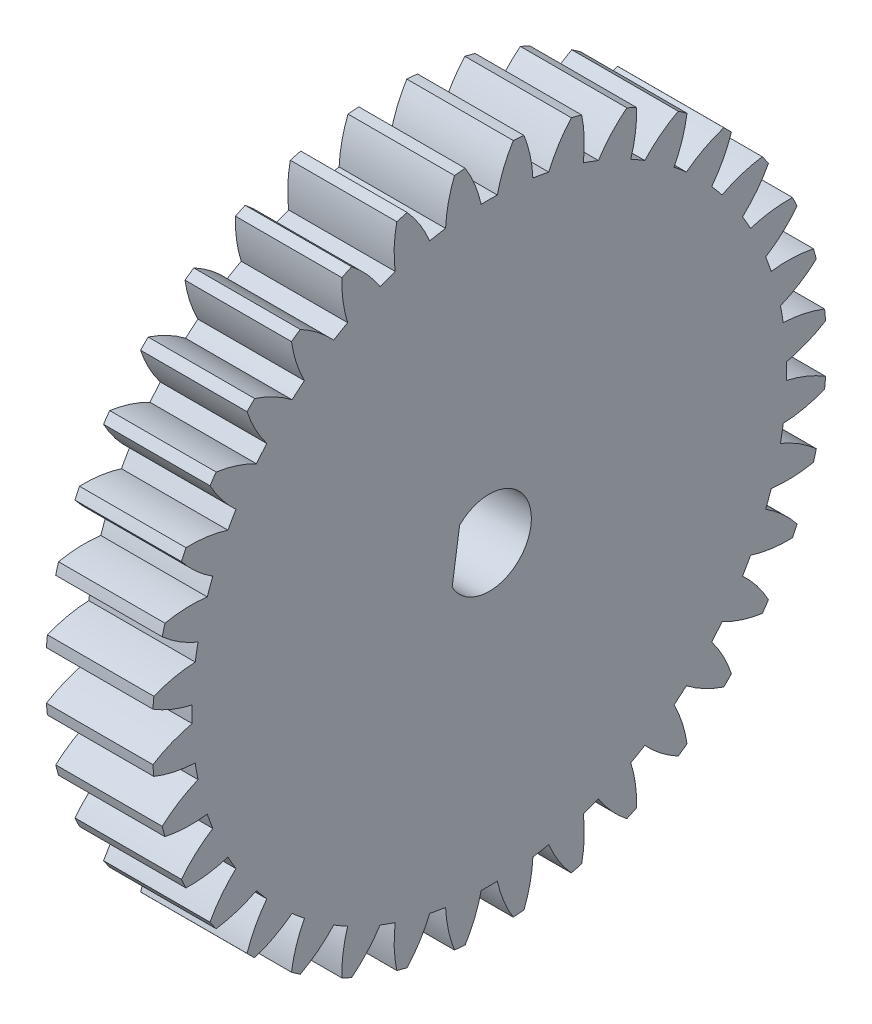
from build123d import *

# Parameters (mm, degrees)
BASPROSKE_W         = 6
BASPROSKE_H         = 19
TOOTHCUT_DEPTH      = 28.531799796
TEETHCUTS_COUNT     = 36
BORE_DEPTH          = 50.0000508
SKETCH4_R           = 6.369355929
BOSS_EXTRUDE1_DEPTH = 6
CUT_EXTRUDE1_DEPTH  = 6


with BuildPart() as part:
    # BasProSke → Base-Revolve (revolve)
    with BuildSketch(Plane(origin=(0, 0, 0), x_dir=(1, 0, 0), z_dir=(0, 1, 0)), mode=Mode.PRIVATE) as base_revolve_sk:
        with Locations((3, 9.5)):
            Rectangle(BASPROSKE_W, BASPROSKE_H)
    revolve(base_revolve_sk.sketch.rotate(Axis((-10, 0, 0), (1, 0, 0)), 180), axis=Axis((-10, 0, 0), (1, 0, 0)))

    # TooCutSke → ToothCut (cut, through all)
    with BuildSketch(Plane(origin=(0, 0, 0), x_dir=(0, 0, -1), z_dir=(1, 0, 0))):
        with BuildLine():
            ThreePointArc((0.454664826, 16.742827745), (0, 16.749), (-0.454664826, 16.742827745))
            ThreePointArc((-0.454664826, 16.742827745), (-0.817558311, 17.898033097), (-1.368909141, 18.976088452))
            ThreePointArc((-1.368909141, 18.976088452), (0, 19.0254), (1.368909141, 18.976088452))
            ThreePointArc((1.368909141, 18.976088452), (0.817558311, 17.898033097), (0.454664826, 16.742827745))
        make_face()
    toothcut = extrude(amount=TOOTHCUT_DEPTH, mode=Mode.SUBTRACT)

    # TeethCuts: ToothCut ×36 about axis
    teethcuts_axis = Axis((0, 0, 0), (1, 0, 0))
    for i in range(1, TEETHCUTS_COUNT):
        add(toothcut.rotate(teethcuts_axis, i * 360 / TEETHCUTS_COUNT), mode=Mode.SUBTRACT)

    # BorSke → Bore (cut, symmetric)
    with BuildSketch(Plane(origin=(0, 0, 0), x_dir=(0, 0, -1), z_dir=(1, 0, 0))):
        with BuildLine():
            Line((-2.200434536, -1.186628775), (-1.755285295, 1.780161098))
            ThreePointArc((-1.755285295, 1.780161098), (2.472324894, -0.370957702), (-2.200434536, -1.186628775))
        make_face()
    extrude(amount=BORE_DEPTH, both=True, mode=Mode.SUBTRACT)

    # Sketch4 → Boss-Extrude1 (add)
    with BuildSketch(Plane(origin=(6, 0, 0), x_dir=(0, 0, -1), z_dir=(1, 0, 0))):
        Circle(SKETCH4_R)
    extrude(amount=-BOSS_EXTRUDE1_DEPTH)

    # Sketch2 → Cut-Extrude1 (cut)
    with BuildSketch(Plane(origin=(6, 0, 0), x_dir=(0, 0, -1), z_dir=(1, 0, 0))):
        with BuildLine():
            Line((-2.09041281, -1.127297337), (-1.66752103, 1.691153043))
            ThreePointArc((-1.66752103, 1.691153043), (2.34870865, -0.352409816), (-2.09041281, -1.127297337))
        make_face()
    extrude(amount=-CUT_EXTRUDE1_DEPTH, mode=Mode.SUBTRACT)


solid = part.part
